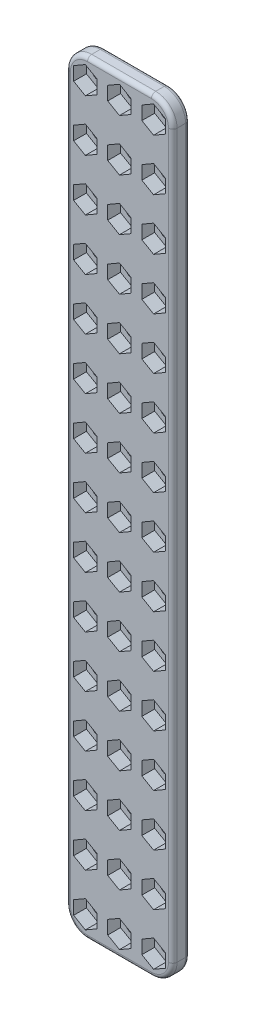
from build123d import *

# Parameters (mm, degrees)
SKETCH_1_W             = 25
SKETCH_1_H             = 10
EXTRUDE_1_DEPTH        = 4
SKETCH_2_R             = 1.5
CUT_EXTRUDE_1_DEPTH    = 15.044571905
CUT_EXTRUDE_2_DEPTH    = 3
SKETCH_4_W             = 25
SKETCH_4_H             = 12.1
EXTRUDE_2_DEPTH        = 4
SKETCH_5_R             = 1.5
CUT_EXTRUDE_3_DEPTH    = 22.55597365
CUT_EXTRUDE_4_DEPTH    = 3
PATTERN_LINEAR_1_COUNT = 14
PATTERN_LINEAR_1_PITCH = 12.1
FILLET_1_R             = 5
FILLET_2_R             = 1


with BuildPart() as part:
    # 草图1 → 凸台-拉伸1 (new body)
    with BuildSketch(Plane.XY):
        Rectangle(SKETCH_1_W, SKETCH_1_H)
    extrude(amount=EXTRUDE_1_DEPTH)

    # 草图2 → 切除-拉伸1 (cut, through all)
    with BuildSketch(Plane.XY.offset(4)):
        Circle(SKETCH_2_R)
        with Locations((-8, 0)):
            Circle(SKETCH_2_R)
        with Locations(Location((8, 0, 0), (0, 0, 180))):
            Circle(SKETCH_2_R)
    extrude(amount=-CUT_EXTRUDE_1_DEPTH, mode=Mode.SUBTRACT)

    # 草图3 → 切除-拉伸2 (cut)
    with BuildSketch(Plane.XY.offset(4)):
        Polygon((-8, 3.175426481), (-10.75, 1.58771324), (-10.75, -1.58771324), (-8, -3.175426481), (-5.25, -1.58771324), (-5.25, 1.58771324), align=None)
        Polygon((0, 3.175426481), (-2.75, 1.58771324), (-2.75, -1.58771324), (0, -3.175426481), (2.75, -1.58771324), (2.75, 1.58771324), align=None)
        Polygon((8, 3.175426481), (5.25, 1.58771324), (5.25, -1.58771324), (8, -3.175426481), (10.75, -1.58771324), (10.75, 1.58771324), align=None)
    extrude(amount=-CUT_EXTRUDE_2_DEPTH, mode=Mode.SUBTRACT)

    # 草图4 → 凸台-拉伸2 (add)
    with BuildSketch(Plane.XY.offset(4)):
        with Locations((0, -11.05)):
            Rectangle(SKETCH_4_W, SKETCH_4_H)
    extrude_2 = extrude(amount=-EXTRUDE_2_DEPTH)

    # 草图5 → 切除-拉伸3 (cut, through all)
    with BuildSketch(Plane.XY.offset(4)):
        with Locations((0, -12.1)):
            Circle(SKETCH_5_R)
        with Locations((-8, -12.1)):
            Circle(SKETCH_5_R)
        with Locations(Location((8, -12.1, 0), (0, 0, 180))):
            Circle(SKETCH_5_R)
    cut_extrude_3 = extrude(amount=-CUT_EXTRUDE_3_DEPTH, mode=Mode.SUBTRACT)

    # 草图6 → 切除-拉伸4 (cut)
    with BuildSketch(Plane.XY.offset(4)):
        Polygon((-8, -8.924573519), (-10.75, -10.51228676), (-10.75, -13.68771324), (-8, -15.275426481), (-5.25, -13.68771324), (-5.25, -10.51228676), align=None)
        Polygon((0, -8.924573519), (-2.75, -10.51228676), (-2.75, -13.68771324), (0, -15.275426481), (2.75, -13.68771324), (2.75, -10.51228676), align=None)
        Polygon((8, -8.924573519), (5.25, -10.51228676), (5.25, -13.68771324), (8, -15.275426481), (10.75, -13.68771324), (10.75, -10.51228676), align=None)
    cut_extrude_4 = extrude(amount=-CUT_EXTRUDE_4_DEPTH, mode=Mode.SUBTRACT)

    # 阵列(线性)1: 凸台-拉伸2, 切除-拉伸3, 切除-拉伸4 ×14
    with Locations(*[(0, -i * PATTERN_LINEAR_1_PITCH, 0) for i in range(1, PATTERN_LINEAR_1_COUNT)]):
        add(extrude_2)
        add(cut_extrude_3, mode=Mode.SUBTRACT)
        add(cut_extrude_4, mode=Mode.SUBTRACT)

    # 圆角1
    fillet_1_edges = [part.edges().sort_by_distance(p)[0] for p in [
        (-12.5, -174.4, 2),
        (12.5, -174.4, 2),
        (-12.5, 5, 2),
        (12.5, 5, 2),
    ]]
    fillet(fillet_1_edges, radius=FILLET_1_R)

    # 圆角2
    fillet_2_edges = [part.edges().sort_by_distance(p)[0] for p in [
        (0, 5, 0),
        (0, 5, 4),
        (12.5, -84.7, 0),
        (0, -174.4, 0),
        (-12.5, -84.7, 0),
        (-11.035533906, -172.935533906, 0),
        (11.035533906, -172.935533906, 0),
        (-11.035533906, 3.535533906, 0),
        (11.035533906, 3.535533906, 0),
        (12.5, -84.7, 4),
        (-12.5, -84.7, 4),
        (0, -174.4, 4),
        (-11.035533906, -172.935533906, 4),
        (11.035533906, -172.935533906, 4),
        (-11.035533906, 3.535533906, 4),
        (11.035533906, 3.535533906, 4),
    ]]
    fillet(fillet_2_edges, radius=FILLET_2_R)


solid = part.part
